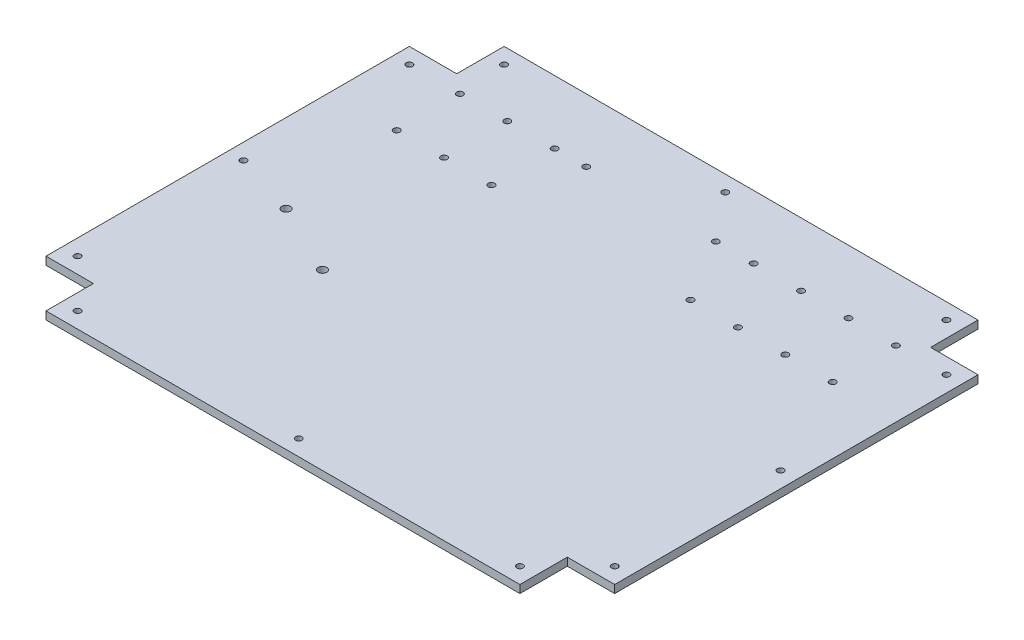
from build123d import *

# Parameters (mm, degrees)
SKETCH1_W           = 457.2
SKETCH1_H           = 368.3
SKETCH1_R           = 2.5527
BOSS_EXTRUDE1_DEPTH = 6.35
CUT_EXTRUDE1_REACH  = 589.126
SKETCH2_W           = 38.1
SKETCH2_H           = 38.1
CUT_EXTRUDE2_REACH  = 589.126
SKETCH3_R           = 2.5527
CUT_EXTRUDE3_REACH  = 589.126
SKETCH5_R           = 3.429


with BuildPart() as part:
    # Sketch1 → Boss-Extrude1 (new body)
    with BuildSketch(Plane(origin=(0, 0, 0), x_dir=(1, 0, 0), z_dir=(0, 1, 0))):
        with Locations((228.6, 184.15)):
            Rectangle(SKETCH1_W, SKETCH1_H)
        with Locations(Location((50.8, 355.6, 0), (0, 0, 270))):
            Circle(SKETCH1_R, mode=Mode.SUBTRACT)
        with Locations(Location((406.4, 355.6, 0), (0, 0, 270))):
            Circle(SKETCH1_R, mode=Mode.SUBTRACT)
        with Locations(Location((406.4, 12.7, 0), (0, 0, 270))):
            Circle(SKETCH1_R, mode=Mode.SUBTRACT)
        with Locations(Location((50.8, 12.7, 0), (0, 0, 270))):
            Circle(SKETCH1_R, mode=Mode.SUBTRACT)
        with Locations(Location((228.6, 12.7, 0), (0, 0, 270))):
            Circle(SKETCH1_R, mode=Mode.SUBTRACT)
        with Locations(Location((228.6, 355.6, 0), (0, 0, 270))):
            Circle(SKETCH1_R, mode=Mode.SUBTRACT)
        with Locations(Location((12.7, 184.15, 0), (0, 0, 270))):
            Circle(SKETCH1_R, mode=Mode.SUBTRACT)
        with Locations(Location((444.5, 184.15, 0), (0, 0, 270))):
            Circle(SKETCH1_R, mode=Mode.SUBTRACT)
        with Locations(Location((12.7, 50.8, 0), (0, 0, 270))):
            Circle(SKETCH1_R, mode=Mode.SUBTRACT)
        with Locations(Location((444.5, 50.8, 0), (0, 0, 270))):
            Circle(SKETCH1_R, mode=Mode.SUBTRACT)
        with Locations(Location((444.5, 317.5, 0), (0, 0, 270))):
            Circle(SKETCH1_R, mode=Mode.SUBTRACT)
        with Locations(Location((12.7, 317.5, 0), (0, 0, 270))):
            Circle(SKETCH1_R, mode=Mode.SUBTRACT)
    extrude(amount=BOSS_EXTRUDE1_DEPTH)

    # Sketch2 → Cut-Extrude1 (cut, up to next)
    with BuildSketch(Plane(origin=(0, 6.35, 0), x_dir=(1, 0, 0), z_dir=(0, 1, 0)), mode=Mode.PRIVATE) as cut_extrude1_sk1:
        with Locations((19.05, 19.05)):
            Rectangle(SKETCH2_W, SKETCH2_H)
    cut_extrude1_tool1 = extrude(cut_extrude1_sk1.sketch, amount=-CUT_EXTRUDE1_REACH, mode=Mode.PRIVATE) & part.part
    # Sketch2 → Cut-Extrude1 (cut, up to next)
    with BuildSketch(Plane(origin=(0, 6.35, 0), x_dir=(1, 0, 0), z_dir=(0, 1, 0)), mode=Mode.PRIVATE) as cut_extrude1_sk2:
        with Locations((19.05, 349.25)):
            Rectangle(SKETCH2_W, SKETCH2_H)
    cut_extrude1_tool2 = extrude(cut_extrude1_sk2.sketch, amount=-CUT_EXTRUDE1_REACH, mode=Mode.PRIVATE) & part.part
    # Sketch2 → Cut-Extrude1 (cut, up to next)
    with BuildSketch(Plane(origin=(0, 6.35, 0), x_dir=(1, 0, 0), z_dir=(0, 1, 0)), mode=Mode.PRIVATE) as cut_extrude1_sk3:
        with Locations((438.15, 349.25)):
            Rectangle(SKETCH2_W, SKETCH2_H)
    cut_extrude1_tool3 = extrude(cut_extrude1_sk3.sketch, amount=-CUT_EXTRUDE1_REACH, mode=Mode.PRIVATE) & part.part
    # Sketch2 → Cut-Extrude1 (cut, up to next)
    with BuildSketch(Plane(origin=(0, 6.35, 0), x_dir=(1, 0, 0), z_dir=(0, 1, 0)), mode=Mode.PRIVATE) as cut_extrude1_sk4:
        with Locations((438.15, 19.05)):
            Rectangle(SKETCH2_W, SKETCH2_H)
    cut_extrude1_tool4 = extrude(cut_extrude1_sk4.sketch, amount=-CUT_EXTRUDE1_REACH, mode=Mode.PRIVATE) & part.part
    add(cut_extrude1_tool1.solids().sort_by_distance((19.05, 6.35, -19.05))[0], mode=Mode.SUBTRACT)
    add(cut_extrude1_tool2.solids().sort_by_distance((19.05, 6.35, -349.25))[0], mode=Mode.SUBTRACT)
    add(cut_extrude1_tool3.solids().sort_by_distance((438.15, 6.35, -349.25))[0], mode=Mode.SUBTRACT)
    add(cut_extrude1_tool4.solids().sort_by_distance((438.15, 6.35, -19.05))[0], mode=Mode.SUBTRACT)

    # Sketch3 → Cut-Extrude2 (cut, up to next)
    with BuildSketch(Plane(origin=(0, 6.35, 0), x_dir=(1, 0, 0), z_dir=(0, 1, 0)), mode=Mode.PRIVATE) as cut_extrude2_sk1:
        with Locations(Location((53.34, 266.7, 0), (0, 0, 270))):
            Circle(SKETCH3_R)
    cut_extrude2_tool1 = extrude(cut_extrude2_sk1.sketch, amount=-CUT_EXTRUDE2_REACH, mode=Mode.PRIVATE) & part.part
    # Sketch3 → Cut-Extrude2 (cut, up to next)
    with BuildSketch(Plane(origin=(0, 6.35, 0), x_dir=(1, 0, 0), z_dir=(0, 1, 0)), mode=Mode.PRIVATE) as cut_extrude2_sk2:
        with Locations(Location((53.34, 317.5, 0), (0, 0, 270))):
            Circle(SKETCH3_R)
    cut_extrude2_tool2 = extrude(cut_extrude2_sk2.sketch, amount=-CUT_EXTRUDE2_REACH, mode=Mode.PRIVATE) & part.part
    # Sketch3 → Cut-Extrude2 (cut, up to next)
    with BuildSketch(Plane(origin=(0, 6.35, 0), x_dir=(1, 0, 0), z_dir=(0, 1, 0)), mode=Mode.PRIVATE) as cut_extrude2_sk3:
        with Locations(Location((91.44, 266.7, 0), (0, 0, 270))):
            Circle(SKETCH3_R)
    cut_extrude2_tool3 = extrude(cut_extrude2_sk3.sketch, amount=-CUT_EXTRUDE2_REACH, mode=Mode.PRIVATE) & part.part
    # Sketch3 → Cut-Extrude2 (cut, up to next)
    with BuildSketch(Plane(origin=(0, 6.35, 0), x_dir=(1, 0, 0), z_dir=(0, 1, 0)), mode=Mode.PRIVATE) as cut_extrude2_sk4:
        with Locations(Location((91.44, 317.5, 0), (0, 0, 270))):
            Circle(SKETCH3_R)
    cut_extrude2_tool4 = extrude(cut_extrude2_sk4.sketch, amount=-CUT_EXTRUDE2_REACH, mode=Mode.PRIVATE) & part.part
    # Sketch3 → Cut-Extrude2 (cut, up to next)
    with BuildSketch(Plane(origin=(0, 6.35, 0), x_dir=(1, 0, 0), z_dir=(0, 1, 0)), mode=Mode.PRIVATE) as cut_extrude2_sk5:
        with Locations(Location((129.54, 266.7, 0), (0, 0, 270))):
            Circle(SKETCH3_R)
    cut_extrude2_tool5 = extrude(cut_extrude2_sk5.sketch, amount=-CUT_EXTRUDE2_REACH, mode=Mode.PRIVATE) & part.part
    # Sketch3 → Cut-Extrude2 (cut, up to next)
    with BuildSketch(Plane(origin=(0, 6.35, 0), x_dir=(1, 0, 0), z_dir=(0, 1, 0)), mode=Mode.PRIVATE) as cut_extrude2_sk6:
        with Locations(Location((129.54, 317.5, 0), (0, 0, 270))):
            Circle(SKETCH3_R)
    cut_extrude2_tool6 = extrude(cut_extrude2_sk6.sketch, amount=-CUT_EXTRUDE2_REACH, mode=Mode.PRIVATE) & part.part
    # Sketch3 → Cut-Extrude2 (cut, up to next)
    with BuildSketch(Plane(origin=(0, 6.35, 0), x_dir=(1, 0, 0), z_dir=(0, 1, 0)), mode=Mode.PRIVATE) as cut_extrude2_sk7:
        with Locations(Location((289.56, 266.7, 0), (0, 0, 270))):
            Circle(SKETCH3_R)
    cut_extrude2_tool7 = extrude(cut_extrude2_sk7.sketch, amount=-CUT_EXTRUDE2_REACH, mode=Mode.PRIVATE) & part.part
    # Sketch3 → Cut-Extrude2 (cut, up to next)
    with BuildSketch(Plane(origin=(0, 6.35, 0), x_dir=(1, 0, 0), z_dir=(0, 1, 0)), mode=Mode.PRIVATE) as cut_extrude2_sk8:
        with Locations(Location((289.56, 317.5, 0), (0, 0, 270))):
            Circle(SKETCH3_R)
    cut_extrude2_tool8 = extrude(cut_extrude2_sk8.sketch, amount=-CUT_EXTRUDE2_REACH, mode=Mode.PRIVATE) & part.part
    # Sketch3 → Cut-Extrude2 (cut, up to next)
    with BuildSketch(Plane(origin=(0, 6.35, 0), x_dir=(1, 0, 0), z_dir=(0, 1, 0)), mode=Mode.PRIVATE) as cut_extrude2_sk9:
        with Locations(Location((403.86, 266.7, 0), (0, 0, 270))):
            Circle(SKETCH3_R)
    cut_extrude2_tool9 = extrude(cut_extrude2_sk9.sketch, amount=-CUT_EXTRUDE2_REACH, mode=Mode.PRIVATE) & part.part
    # Sketch3 → Cut-Extrude2 (cut, up to next)
    with BuildSketch(Plane(origin=(0, 6.35, 0), x_dir=(1, 0, 0), z_dir=(0, 1, 0)), mode=Mode.PRIVATE) as cut_extrude2_sk10:
        with Locations(Location((403.86, 317.5, 0), (0, 0, 270))):
            Circle(SKETCH3_R)
    cut_extrude2_tool10 = extrude(cut_extrude2_sk10.sketch, amount=-CUT_EXTRUDE2_REACH, mode=Mode.PRIVATE) & part.part
    # Sketch3 → Cut-Extrude2 (cut, up to next)
    with BuildSketch(Plane(origin=(0, 6.35, 0), x_dir=(1, 0, 0), z_dir=(0, 1, 0)), mode=Mode.PRIVATE) as cut_extrude2_sk11:
        with Locations(Location((365.76, 266.7, 0), (0, 0, 270))):
            Circle(SKETCH3_R)
    cut_extrude2_tool11 = extrude(cut_extrude2_sk11.sketch, amount=-CUT_EXTRUDE2_REACH, mode=Mode.PRIVATE) & part.part
    # Sketch3 → Cut-Extrude2 (cut, up to next)
    with BuildSketch(Plane(origin=(0, 6.35, 0), x_dir=(1, 0, 0), z_dir=(0, 1, 0)), mode=Mode.PRIVATE) as cut_extrude2_sk12:
        with Locations(Location((365.76, 317.5, 0), (0, 0, 270))):
            Circle(SKETCH3_R)
    cut_extrude2_tool12 = extrude(cut_extrude2_sk12.sketch, amount=-CUT_EXTRUDE2_REACH, mode=Mode.PRIVATE) & part.part
    # Sketch3 → Cut-Extrude2 (cut, up to next)
    with BuildSketch(Plane(origin=(0, 6.35, 0), x_dir=(1, 0, 0), z_dir=(0, 1, 0)), mode=Mode.PRIVATE) as cut_extrude2_sk13:
        with Locations(Location((327.66, 266.7, 0), (0, 0, 270))):
            Circle(SKETCH3_R)
    cut_extrude2_tool13 = extrude(cut_extrude2_sk13.sketch, amount=-CUT_EXTRUDE2_REACH, mode=Mode.PRIVATE) & part.part
    # Sketch3 → Cut-Extrude2 (cut, up to next)
    with BuildSketch(Plane(origin=(0, 6.35, 0), x_dir=(1, 0, 0), z_dir=(0, 1, 0)), mode=Mode.PRIVATE) as cut_extrude2_sk14:
        with Locations(Location((327.66, 317.5, 0), (0, 0, 270))):
            Circle(SKETCH3_R)
    cut_extrude2_tool14 = extrude(cut_extrude2_sk14.sketch, amount=-CUT_EXTRUDE2_REACH, mode=Mode.PRIVATE) & part.part
    # Sketch3 → Cut-Extrude2 (cut, up to next)
    with BuildSketch(Plane(origin=(0, 6.35, 0), x_dir=(1, 0, 0), z_dir=(0, 1, 0)), mode=Mode.PRIVATE) as cut_extrude2_sk15:
        with Locations(Location((259.08, 317.5, 0), (0, 0, 270))):
            Circle(SKETCH3_R)
    cut_extrude2_tool15 = extrude(cut_extrude2_sk15.sketch, amount=-CUT_EXTRUDE2_REACH, mode=Mode.PRIVATE) & part.part
    # Sketch3 → Cut-Extrude2 (cut, up to next)
    with BuildSketch(Plane(origin=(0, 6.35, 0), x_dir=(1, 0, 0), z_dir=(0, 1, 0)), mode=Mode.PRIVATE) as cut_extrude2_sk16:
        with Locations(Location((154.94, 317.5, 0), (0, 0, 270))):
            Circle(SKETCH3_R)
    cut_extrude2_tool16 = extrude(cut_extrude2_sk16.sketch, amount=-CUT_EXTRUDE2_REACH, mode=Mode.PRIVATE) & part.part
    add(cut_extrude2_tool1.solids().sort_by_distance((53.34, 6.35, -266.7))[0], mode=Mode.SUBTRACT)
    add(cut_extrude2_tool2.solids().sort_by_distance((53.34, 6.35, -317.5))[0], mode=Mode.SUBTRACT)
    add(cut_extrude2_tool3.solids().sort_by_distance((91.44, 6.35, -266.7))[0], mode=Mode.SUBTRACT)
    add(cut_extrude2_tool4.solids().sort_by_distance((91.44, 6.35, -317.5))[0], mode=Mode.SUBTRACT)
    add(cut_extrude2_tool5.solids().sort_by_distance((129.54, 6.35, -266.7))[0], mode=Mode.SUBTRACT)
    add(cut_extrude2_tool6.solids().sort_by_distance((129.54, 6.35, -317.5))[0], mode=Mode.SUBTRACT)
    add(cut_extrude2_tool7.solids().sort_by_distance((289.56, 6.35, -266.7))[0], mode=Mode.SUBTRACT)
    add(cut_extrude2_tool8.solids().sort_by_distance((289.56, 6.35, -317.5))[0], mode=Mode.SUBTRACT)
    add(cut_extrude2_tool9.solids().sort_by_distance((403.86, 6.35, -266.7))[0], mode=Mode.SUBTRACT)
    add(cut_extrude2_tool10.solids().sort_by_distance((403.86, 6.35, -317.5))[0], mode=Mode.SUBTRACT)
    add(cut_extrude2_tool11.solids().sort_by_distance((365.76, 6.35, -266.7))[0], mode=Mode.SUBTRACT)
    add(cut_extrude2_tool12.solids().sort_by_distance((365.76, 6.35, -317.5))[0], mode=Mode.SUBTRACT)
    add(cut_extrude2_tool13.solids().sort_by_distance((327.66, 6.35, -266.7))[0], mode=Mode.SUBTRACT)
    add(cut_extrude2_tool14.solids().sort_by_distance((327.66, 6.35, -317.5))[0], mode=Mode.SUBTRACT)
    add(cut_extrude2_tool15.solids().sort_by_distance((259.08, 6.35, -317.5))[0], mode=Mode.SUBTRACT)
    add(cut_extrude2_tool16.solids().sort_by_distance((154.94, 6.35, -317.5))[0], mode=Mode.SUBTRACT)

    # Sketch5 → Cut-Extrude3 (cut, up to next)
    with BuildSketch(Plane.XZ, mode=Mode.PRIVATE) as cut_extrude3_sk1:
        with Locations(Location((63.5, -167.64, 0), (0, 0, 270))):
            Circle(SKETCH5_R)
    cut_extrude3_tool1 = extrude(cut_extrude3_sk1.sketch, amount=-CUT_EXTRUDE3_REACH, mode=Mode.PRIVATE) & part.part
    # Sketch5 → Cut-Extrude3 (cut, up to next)
    with BuildSketch(Plane.XZ, mode=Mode.PRIVATE) as cut_extrude3_sk2:
        with Locations(Location((120.65, -139.7, 0), (0, 0, 270))):
            Circle(SKETCH5_R)
    cut_extrude3_tool2 = extrude(cut_extrude3_sk2.sketch, amount=-CUT_EXTRUDE3_REACH, mode=Mode.PRIVATE) & part.part
    add(cut_extrude3_tool1.solids().sort_by_distance((63.5, 0, -167.64))[0], mode=Mode.SUBTRACT)
    add(cut_extrude3_tool2.solids().sort_by_distance((120.65, 0, -139.7))[0], mode=Mode.SUBTRACT)


solid = part.part
